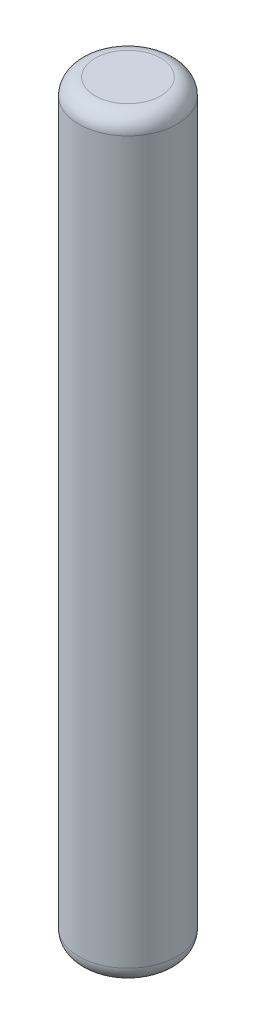
from build123d import *

# Parameters (mm, degrees)
SKETCH_2_R      = 1.5
EXTRUDE_1_DEPTH = 11.5
FILLET_4_R      = 0.5


with BuildPart() as part:
    # 草图2 → 凸台-拉伸1 (new, symmetric)
    with BuildSketch(Plane(origin=(0, 0, 0), x_dir=(1, 0, 0), z_dir=(0, 1, 0))):
        with Locations(Location((0, 0, 0), (0, 0, 270))):
            Circle(SKETCH_2_R)
    extrude(amount=EXTRUDE_1_DEPTH, both=True)

    # 圆角4
    fillet_4_edges = [part.edges().sort_by_distance(p)[0] for p in [
        (0, -11.5, -1.5),
        (0, 11.5, -1.5),
    ]]
    fillet(fillet_4_edges, radius=FILLET_4_R)


solid = part.part
